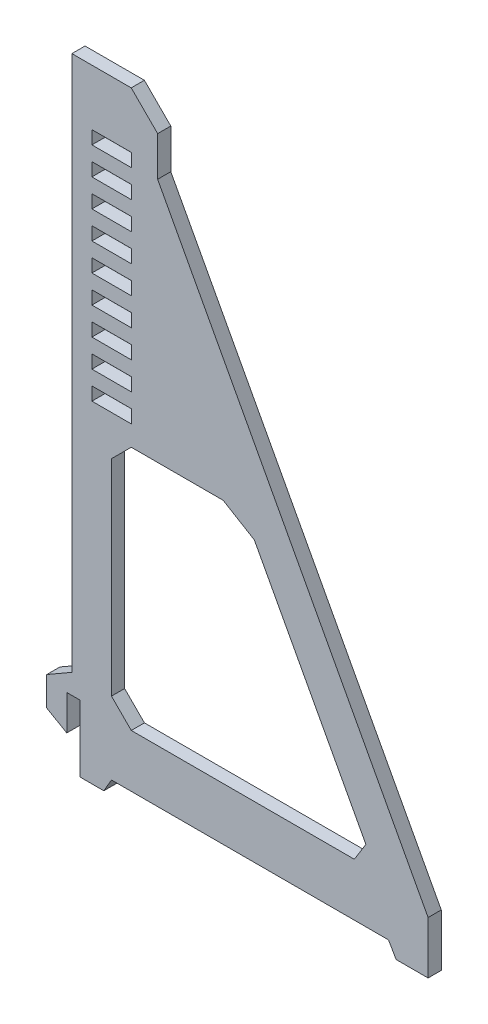
from build123d import *

# Parameters (mm, degrees)
BOSS_EXTRUDE1_DEPTH = 25.4
SCALE1_SCALE        = 25.365591398
SKETCH3_W           = 1042.369657432
SKETCH3_H           = 1273.252838884
CUT_EXTRUDE1_DEPTH  = 618.998
CHAMFER1_SIZE       = 50.8
CHAMFER2_SIZE       = 38.1
CHAMFER3_SIZE       = 40.64
CHAMFER3_SIZE2      = 40.894583593
CHAMFER4_SIZE       = 40.64
CHAMFER4_SIZE2      = 41.405123541
SKETCH4_W           = 25.4
SKETCH4_H           = 106.871356521
CUT_EXTRUDE2_DEPTH  = 618.998
SKETCH5_W           = 76.2
SKETCH5_H           = 25.4
CUT_EXTRUDE3_DEPTH  = 800.296261243
LPATTERN4_COUNT     = 2
LPATTERN4_PITCH     = 106.68
CUT_EXTRUDE4_DEPTH  = 25.4


with BuildPart() as part:
    # Sketch1 → Boss-Extrude1 (new body)
    with BuildSketch(Plane.XY):
        Polygon((-15.617276252, -25), (-13.194626522, -25), (-12.617276252, -24), (8.382723748, -24), (8.960074017, -25), (11.382723748, -25), (11.382723748, -21.02978992), (-9.117276252, 17.18), (-9.117276252, 22.18), (-15.617276252, 22.18), (-15.617276252, -18.433701616), (-17.522276252, -19.533553879), (-17.522276252, -21.733258405), (-15.617276252, -22.833110667), align=None)
        Polygon((-12.617276252, -20), (7.425731864, -20), (-2.548020957, -1.41), (-12.617276252, -1.41), align=None, mode=Mode.SUBTRACT)
    extrude(amount=BOSS_EXTRUDE1_DEPTH)


with BuildPart() as part_1:
    # Scale1: scaled about (-6.821956607, -3.861646577, 12.7)
    add(part.part.scale(SCALE1_SCALE).moved(Location((166.22100722, 94.091302618, -309.443010753))))

    # Sketch3 → Cut-Extrude1 (cut)
    with BuildSketch(Plane(origin=(0, 0, -309.443010753), x_dir=(-1, 0, 0), z_dir=(0, 0, -1))):
        with Locations((-113.67141854, 36.826872795)):
            Rectangle(SKETCH3_W, SKETCH3_H)
    extrude(amount=-CUT_EXTRUDE1_DEPTH, mode=Mode.SUBTRACT)

    # Chamfer1
    chamfer1_edges = [part_1.edges().sort_by_distance(p)[0] for p in [
        (-65.044096862, 656.700119822, 322.199),
    ]]
    chamfer(chamfer1_edges, length=CHAMFER1_SIZE)

    # Chamfer2
    chamfer2_edges = [part_1.edges().sort_by_distance(p)[0] for p in [
        (-153.823666755, -413.220525339, 322.199),
        (-153.823666755, 58.325818747, 322.199),
    ]]
    chamfer(chamfer2_edges, length=CHAMFER2_SIZE)

    # Chamfer3
    chamfer3_edges = [part_1.edges().sort_by_distance(p)[0] for p in [
        (101.588948743, 58.325818747, 322.199),
    ]]
    chamfer3_side = [part_1.faces().sort_by_distance(p)[0] for p in [
        (-7.067359006, 58.325818747, 322.199),
    ]]
    chamfer(chamfer3_edges, length=CHAMFER3_SIZE, length2=CHAMFER3_SIZE2, reference=chamfer3_side[0])

    # Chamfer4
    chamfer4_edges = [part_1.edges().sort_by_distance(p)[0] for p in [
        (354.579087503, -413.220525339, 322.199),
    ]]
    chamfer4_side = [part_1.faces().sort_by_distance(p)[0] for p in [
        (237.750829348, -195.465247251, 322.199),
    ]]
    chamfer(chamfer4_edges, length=CHAMFER4_SIZE, length2=CHAMFER4_SIZE2, reference=chamfer4_side[0])

    # Sketch4 → Cut-Extrude2 (cut)
    with BuildSketch(Plane.XY.offset(334.843010753)):
        with Locations((-227.077270504, -486.612804068)):
            Rectangle(SKETCH4_W, SKETCH4_H)
    extrude(amount=-CUT_EXTRUDE2_DEPTH, mode=Mode.SUBTRACT)

    # Sketch5 → Cut-Extrude3 (cut, through all)
    with BuildSketch(Plane.XY.offset(334.843010753)):
        with Locations((-153.322884144, 323.297517672)):
            Rectangle(SKETCH5_W, SKETCH5_H)
        with Locations((-153.322884144, 216.617517672)):
            Rectangle(SKETCH5_W, SKETCH5_H)
        with Locations((-153.322884144, 429.977517672)):
            Rectangle(SKETCH5_W, SKETCH5_H)
        with Locations((-153.322884144, 376.637517672)):
            Rectangle(SKETCH5_W, SKETCH5_H)
        with Locations((-153.322884144, 269.957517672)):
            Rectangle(SKETCH5_W, SKETCH5_H)
        with Locations((-153.322884144, 163.277517672)):
            Rectangle(SKETCH5_W, SKETCH5_H)
        with Locations((-153.322884144, 109.937517672)):
            Rectangle(SKETCH5_W, SKETCH5_H)
    cut_extrude3 = extrude(amount=-CUT_EXTRUDE3_DEPTH, mode=Mode.SUBTRACT)

    # LPattern4: Cut-Extrude3 ×2
    with Locations(*[(0, i * LPATTERN4_PITCH, 0) for i in range(1, LPATTERN4_COUNT)]):
        add(cut_extrude3, mode=Mode.SUBTRACT)

    # Sketch6 → Cut-Extrude4 (cut)
    with BuildSketch(Plane.ZY.offset(214.377270504)):
        Polygon((334.843010753, -433.177125807), (309.554989247, -433.177125807), (334.843010753, -411.957956289), align=None)
    extrude(amount=CUT_EXTRUDE4_DEPTH, mode=Mode.SUBTRACT)


solid = part_1.part
